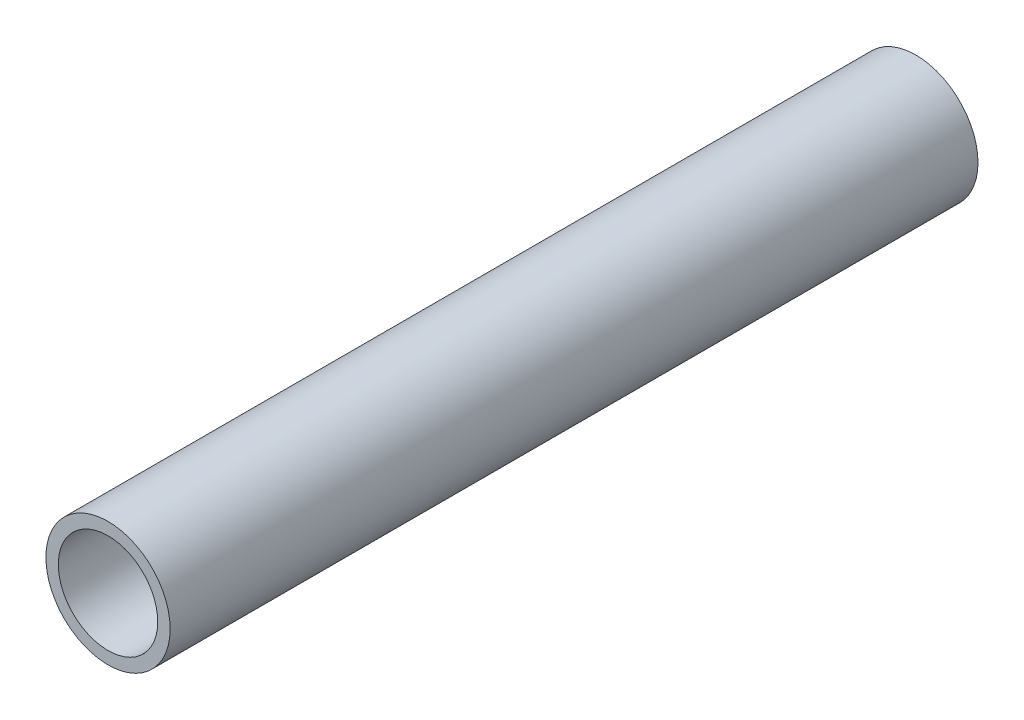
from build123d import *

# Parameters (mm, degrees)
SKETCH1_R           = 5
SKETCH1_R_2         = 4
BOSS_EXTRUDE1_DEPTH = 65


with BuildPart() as part:
    # Sketch1 → Boss-Extrude1 (new body)
    with BuildSketch(Plane.XY):
        Circle(SKETCH1_R)
        Circle(SKETCH1_R_2, mode=Mode.SUBTRACT)
    extrude(amount=BOSS_EXTRUDE1_DEPTH)


solid = part.part
